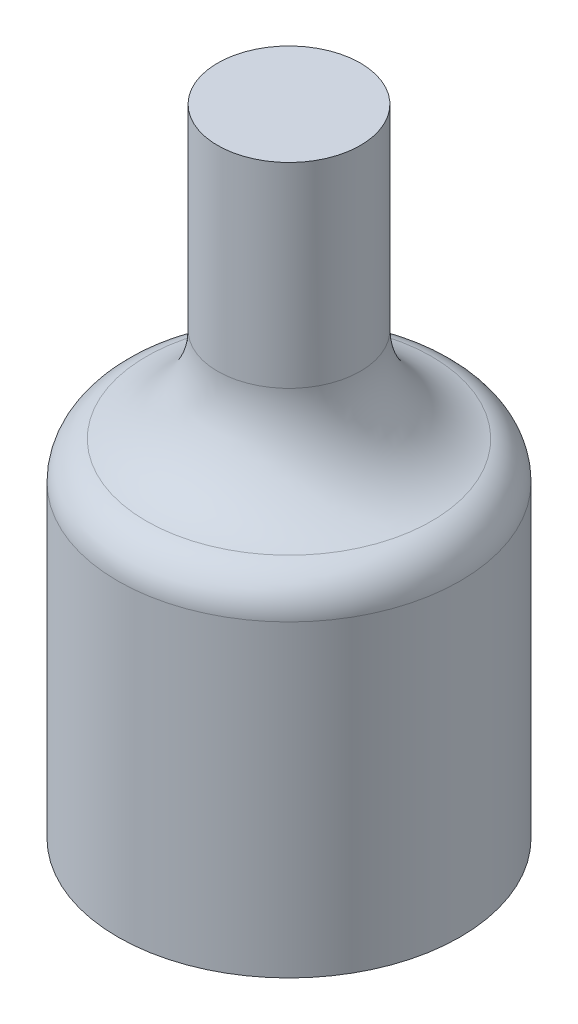
from build123d import *

# Parameters (mm, degrees)
CUT_EXTRUDE1_DEPTH = 15.875
FILLET1_R          = 6.35
FILLET2_R          = 2.54


with BuildPart() as part:
    # Sketch1 → Revolve1 (revolve)
    with BuildSketch(Plane.XY, mode=Mode.PRIVATE) as revolve1_sk:
        Polygon((0, 41.275), (4.6355, 41.275), (4.6355, 22.225), (11.1125, 22.225), (11.1125, 0), (0, 0), align=None)
    revolve(revolve1_sk.sketch.rotate(Axis((0, 0, 0), (0, 1, 0)), 90), axis=Axis((0, 0, 0), (0, 1, 0)))

    # Sketch2 → Cut-Extrude1 (cut)
    with BuildSketch(Plane.XZ):
        Polygon((6.604, 3.812821178), (0, 7.625642355), (-6.604, 3.812821178), (-6.604, -3.812821178), (0, -7.625642355), (6.604, -3.812821178), align=None)
    extrude(amount=-CUT_EXTRUDE1_DEPTH, mode=Mode.SUBTRACT)

    # Fillet1
    fillet1_edges = [part.edges().sort_by_distance(p)[0] for p in [
        (0, 22.225, 4.6355),
    ]]
    fillet(fillet1_edges, radius=FILLET1_R)

    # Fillet2
    fillet2_edges = [part.edges().sort_by_distance(p)[0] for p in [
        (0, 22.225, 11.1125),
    ]]
    fillet(fillet2_edges, radius=FILLET2_R)


solid = part.part
